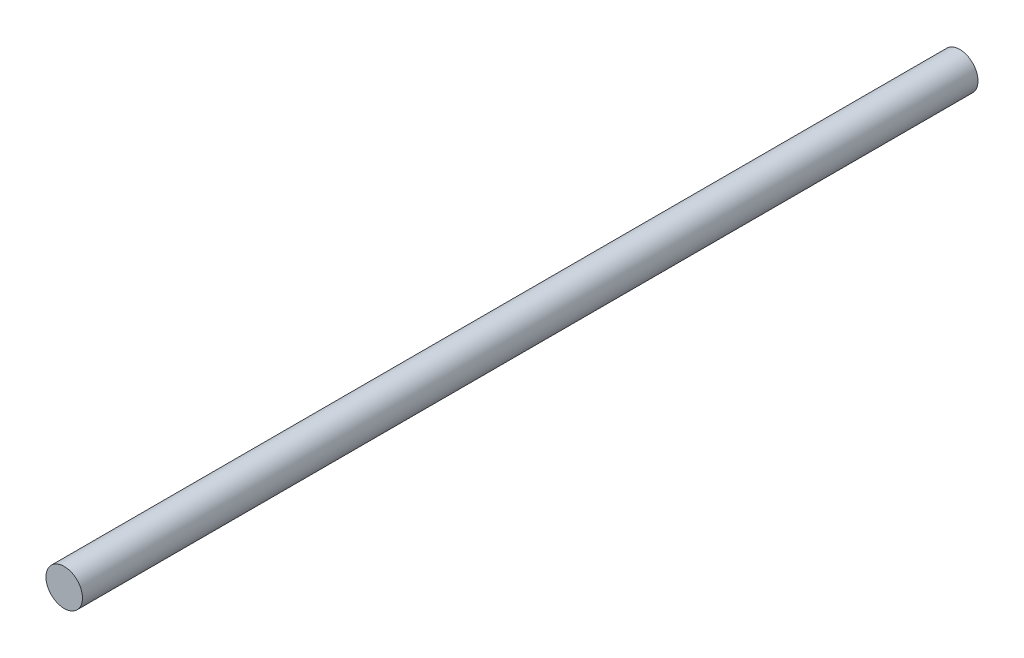
from build123d import *

# Parameters (mm, degrees)
SKETCH2_R           = 0.815
BOSS_EXTRUDE2_DEPTH = 40


with BuildPart() as part:
    # Sketch2 → Boss-Extrude2 (new body)
    with BuildSketch(Plane.XY):
        Circle(SKETCH2_R)
    extrude(amount=BOSS_EXTRUDE2_DEPTH)


solid = part.part
